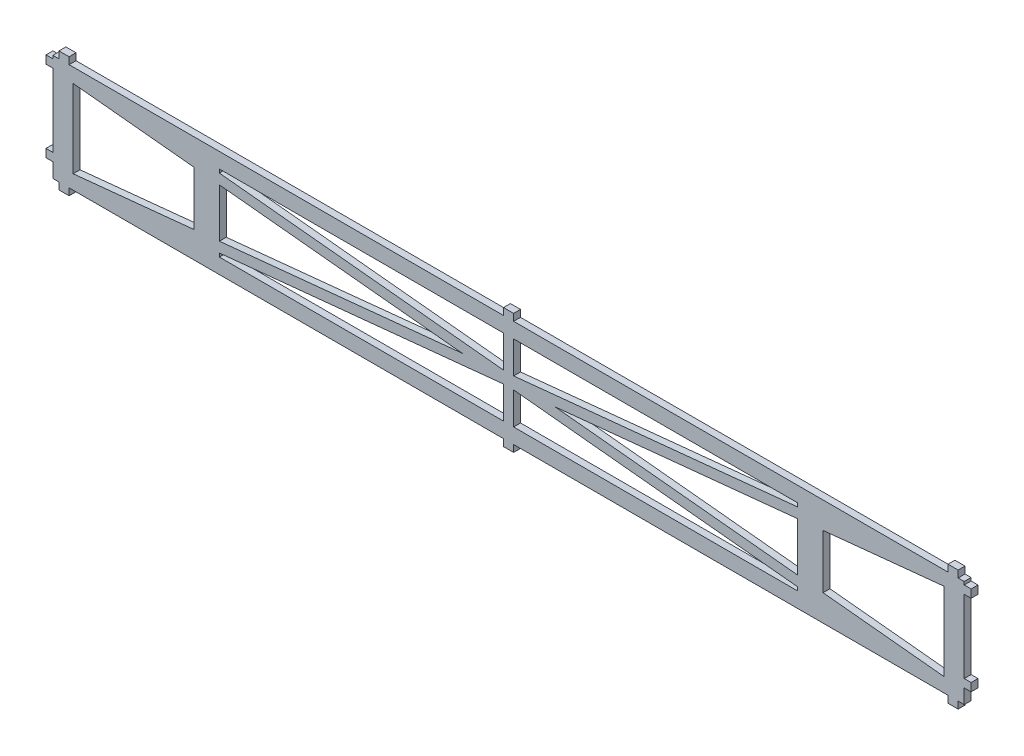
from build123d import *

# Parameters (mm, degrees)
BOSS_EXTRUDE1_DEPTH = 1.7272


with BuildPart() as part:
    # Sketch1 → Boss-Extrude1 (new body)
    with BuildSketch(Plane.XY):
        Polygon((-114.3, 13.37945), (-112.776, 13.37945), (-112.776, 15.10665), (-110.236, 15.10665), (-110.236, 13.37945), (-1.27, 13.37945), (-1.27, 15.10665), (1.27, 15.10665), (1.27, 13.37945), (110.236, 13.37945), (110.236, 15.10665), (112.776, 15.10665), (112.776, 13.37945), (114.3, 13.37945), (114.3, 12.61745), (116.0272, 12.61745), (116.0272, 10.58545), (114.3, 10.58545), (114.3, -7.70255), (116.0272, -7.70255), (116.0272, -9.73455), (114.3, -9.73455), (114.3, -13.37945), (112.776, -13.37945), (112.776, -15.10665), (110.236, -15.10665), (110.236, -13.37945), (1.27, -13.37945), (1.27, -15.10665), (-1.27, -15.10665), (-1.27, -13.37945), (-110.236, -13.37945), (-110.236, -15.10665), (-112.776, -15.10665), (-112.776, -13.37945), (-114.3, -13.37945), (-114.3, -9.73455), (-116.0272, -9.73455), (-116.0272, -7.70255), (-114.3, -7.70255), (-114.3, 10.58545), (-116.0272, 10.58545), (-116.0272, 12.61745), (-114.3, 12.61745), align=None)
        Polygon((-1.27, -1.517324769), (-72.54, -8.677584102), (-72.54, -9.56945), (-1.27, -9.56945), align=None, mode=Mode.SUBTRACT)
        Polygon((-78.89, -6.76276081), (-109.22, -9.80991481), (-109.22, 9.80991481), (-78.89, 6.76276081), align=None, mode=Mode.SUBTRACT)
        Polygon((-11.576521468, 0), (-72.54, -6.124797477), (-72.54, 6.124797477), align=None, mode=Mode.SUBTRACT)
        Polygon((-1.27, 9.56945), (-72.54, 9.56945), (-72.54, 8.677584102), (-1.27, 1.517324769), align=None, mode=Mode.SUBTRACT)
        Polygon((1.27, 1.517324769), (72.54, 8.677584102), (72.54, 9.56945), (1.27, 9.56945), align=None, mode=Mode.SUBTRACT)
        Polygon((78.89, 6.76276081), (109.22, 9.80991481), (109.22, -9.80991481), (78.89, -6.76276081), align=None, mode=Mode.SUBTRACT)
        Polygon((72.54, -6.124797477), (72.54, 6.124797477), (11.576521468, 0), align=None, mode=Mode.SUBTRACT)
        Polygon((1.27, -9.56945), (72.54, -9.56945), (72.54, -8.677584102), (1.27, -1.517324769), align=None, mode=Mode.SUBTRACT)
    extrude(amount=BOSS_EXTRUDE1_DEPTH)


solid = part.part
